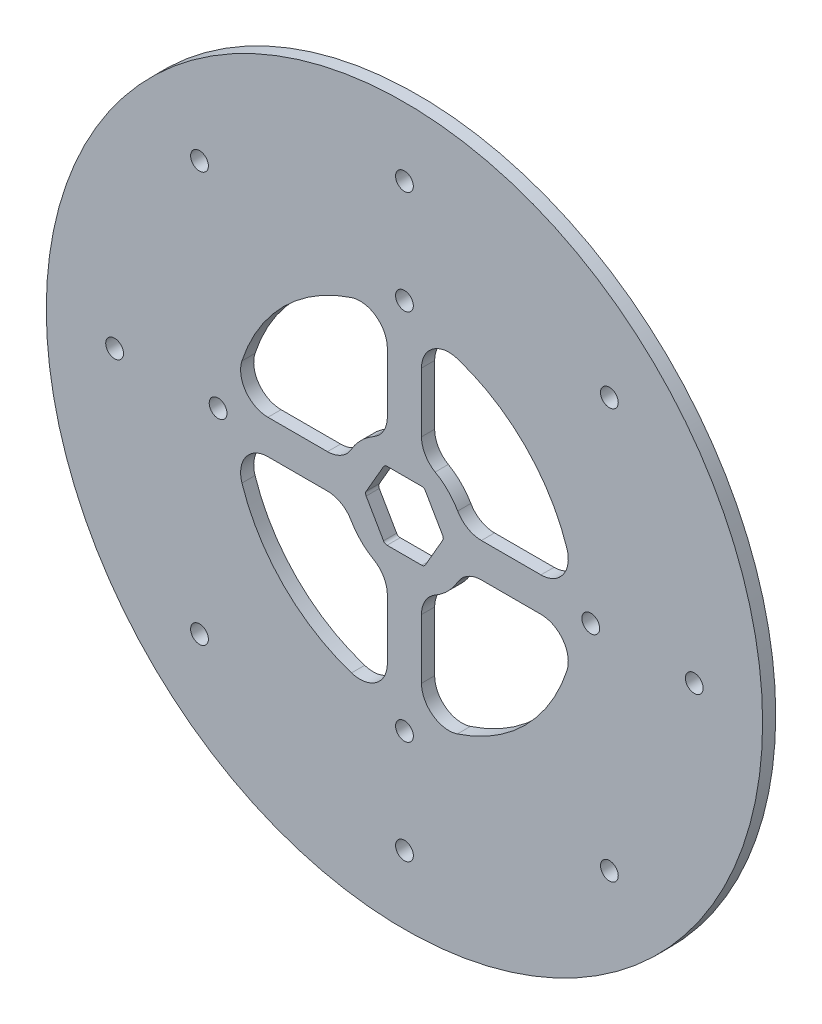
from build123d import *

# Parameters (mm, degrees)
SKETCH1_R           = 66.548
SKETCH1_R_2         = 1.651
BOSS_EXTRUDE1_DEPTH = 2.4384
FILLET6_R           = 0.762


with BuildPart() as part:
    # Sketch1 → Boss-Extrude1 (new body)
    with BuildSketch(Plane.XY):
        Circle(SKETCH1_R)
        with Locations((0, 53.848)):
            Circle(SKETCH1_R_2, mode=Mode.SUBTRACT)
        with Locations((0, 34.619591715)):
            Circle(SKETCH1_R_2, mode=Mode.SUBTRACT)
        with Locations((34.619591715, 0)):
            Circle(SKETCH1_R_2, mode=Mode.SUBTRACT)
        with Locations((0, -34.619591715)):
            Circle(SKETCH1_R_2, mode=Mode.SUBTRACT)
        with Locations((-34.619591715, 0)):
            Circle(SKETCH1_R_2, mode=Mode.SUBTRACT)
        with Locations((38.076285953, 38.076285953)):
            Circle(SKETCH1_R_2, mode=Mode.SUBTRACT)
        with Locations((53.848, 0)):
            Circle(SKETCH1_R_2, mode=Mode.SUBTRACT)
        with Locations((38.076285953, -38.076285953)):
            Circle(SKETCH1_R_2, mode=Mode.SUBTRACT)
        with Locations((0, -53.848)):
            Circle(SKETCH1_R_2, mode=Mode.SUBTRACT)
        with Locations((-38.076285953, -38.076285953)):
            Circle(SKETCH1_R_2, mode=Mode.SUBTRACT)
        with Locations((-53.848, 0)):
            Circle(SKETCH1_R_2, mode=Mode.SUBTRACT)
        with Locations((-38.076285953, 38.076285953)):
            Circle(SKETCH1_R_2, mode=Mode.SUBTRACT)
        with BuildLine():
            Line((25.360281446, 3.175), (14.298079416, 3.175))
            ThreePointArc((14.298079416, 3.175), (11.758079416, 3.855590949), (9.898670365, 5.715))
            ThreePointArc((9.898670365, 5.715), (8.082230509, 8.082230509), (5.715, 9.898670365))
            ThreePointArc((5.715, 9.898670365), (3.855590949, 11.758079416), (3.175, 14.298079416))
            Line((3.175, 14.298079416), (3.175, 25.360281446))
            ThreePointArc((3.175, 25.360281446), (5.270146171, 29.470883302), (9.827380952, 30.190811245))
            ThreePointArc((9.827380952, 30.190811245), (22.450640303, 22.450640303), (30.190811245, 9.827380952))
            ThreePointArc((30.190811245, 9.827380952), (29.470883302, 5.270146171), (25.360281446, 3.175))
        make_face(mode=Mode.SUBTRACT)
        with BuildLine():
            Line((-3.175, 25.360281446), (-3.175, 14.298079416))
            ThreePointArc((-3.175, 14.298079416), (-3.855590949, 11.758079416), (-5.715, 9.898670365))
            ThreePointArc((-5.715, 9.898670365), (-8.082230509, 8.082230509), (-9.898670365, 5.715))
            ThreePointArc((-9.898670365, 5.715), (-11.758079416, 3.855590949), (-14.298079416, 3.175))
            Line((-14.298079416, 3.175), (-25.360281446, 3.175))
            ThreePointArc((-25.360281446, 3.175), (-29.470883302, 5.270146171), (-30.190811245, 9.827380952))
            ThreePointArc((-30.190811245, 9.827380952), (-22.450640303, 22.450640303), (-9.827380952, 30.190811245))
            ThreePointArc((-9.827380952, 30.190811245), (-5.270146171, 29.470883302), (-3.175, 25.360281446))
        make_face(mode=Mode.SUBTRACT)
        with BuildLine():
            Line((3.175, -25.360281446), (3.175, -14.298079416))
            ThreePointArc((3.175, -14.298079416), (3.855590949, -11.758079416), (5.715, -9.898670365))
            ThreePointArc((5.715, -9.898670365), (8.082230509, -8.082230509), (9.898670365, -5.715))
            ThreePointArc((9.898670365, -5.715), (11.758079416, -3.855590949), (14.298079416, -3.175))
            Line((14.298079416, -3.175), (25.360281446, -3.175))
            ThreePointArc((25.360281446, -3.175), (29.470883302, -5.270146171), (30.190811245, -9.827380952))
            ThreePointArc((30.190811245, -9.827380952), (22.450640303, -22.450640303), (9.827380952, -30.190811245))
            ThreePointArc((9.827380952, -30.190811245), (5.270146171, -29.470883302), (3.175, -25.360281446))
        make_face(mode=Mode.SUBTRACT)
        Polygon((7.332348419, 0), (3.666174209, 6.35), (-3.666174209, 6.35), (-7.332348419, 0), (-3.666174209, -6.35), (3.666174209, -6.35), align=None, mode=Mode.SUBTRACT)
        with BuildLine():
            Line((-25.360281446, -3.175), (-14.298079416, -3.175))
            ThreePointArc((-14.298079416, -3.175), (-11.758079416, -3.855590949), (-9.898670365, -5.715))
            ThreePointArc((-9.898670365, -5.715), (-8.082230509, -8.082230509), (-5.715, -9.898670365))
            ThreePointArc((-5.715, -9.898670365), (-3.855590949, -11.758079416), (-3.175, -14.298079416))
            Line((-3.175, -14.298079416), (-3.175, -25.360281446))
            ThreePointArc((-3.175, -25.360281446), (-5.270146171, -29.470883302), (-9.827380952, -30.190811245))
            ThreePointArc((-9.827380952, -30.190811245), (-22.450640303, -22.450640303), (-30.190811245, -9.827380952))
            ThreePointArc((-30.190811245, -9.827380952), (-29.470883302, -5.270146171), (-25.360281446, -3.175))
        make_face(mode=Mode.SUBTRACT)
    extrude(amount=BOSS_EXTRUDE1_DEPTH)

    # Fillet6
    fillet6_edges = [part.edges().sort_by_distance(p)[0] for p in [
        (3.666174209, -6.35, 1.2192),
        (7.332348419, 0, 1.2192),
        (3.666174209, 6.35, 1.2192),
        (-3.666174209, 6.35, 1.2192),
        (-7.332348419, 0, 1.2192),
        (-3.666174209, -6.35, 1.2192),
    ]]
    fillet(fillet6_edges, radius=FILLET6_R)


solid = part.part
